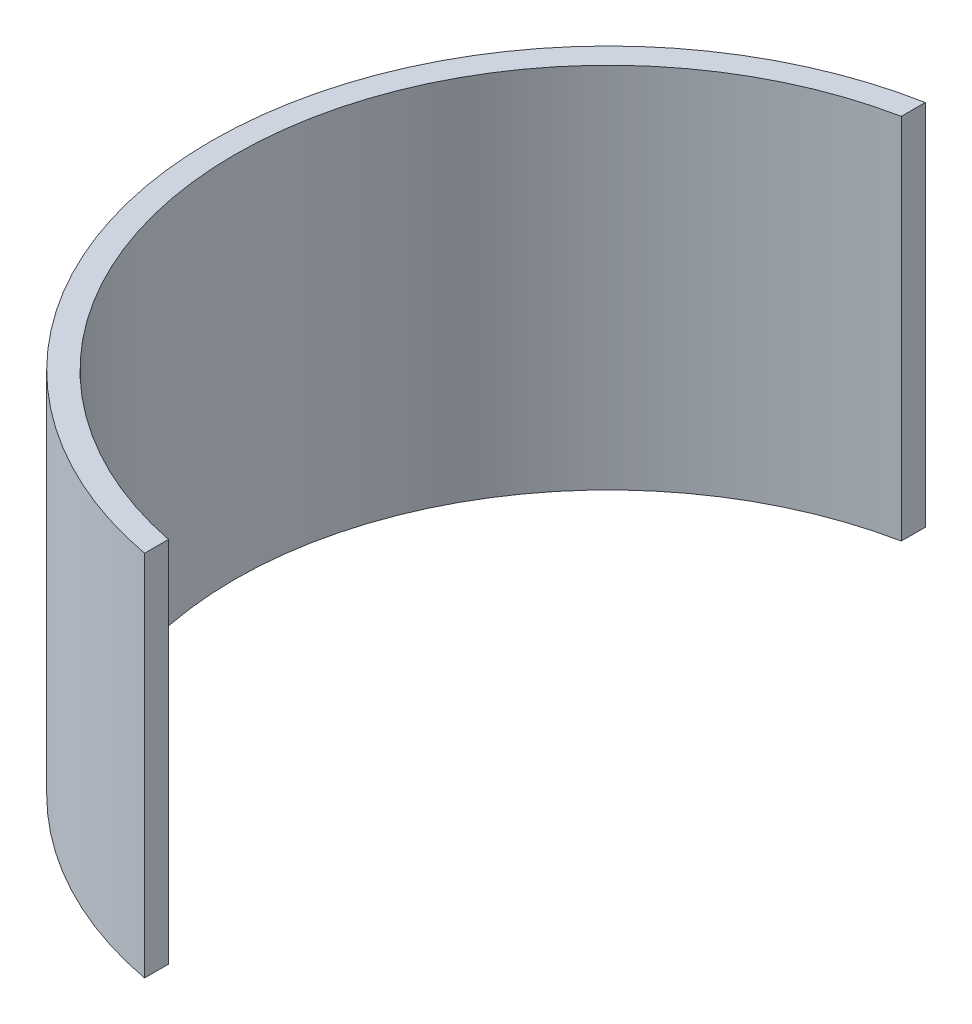
from build123d import *

# Parameters (mm, degrees)
BOSS_EXTRUDE1_DEPTH = 50
SKETCH2_W           = 10
SKETCH2_H           = 108
CUT_EXTRUDE1_DEPTH  = 92.279789658


with BuildPart() as part:
    # Sketch1 → Boss-Extrude1 (new body)
    with BuildSketch(Plane(origin=(0, 0, 0), x_dir=(1, 0, 0), z_dir=(0, 1, 0))):
        with BuildLine():
            Line((0, 54), (0, 50.8))
            ThreePointArc((0, 50.8), (-50.8, 0), (0, -50.8))
            Line((0, -50.8), (0, -54))
            ThreePointArc((0, -54), (-54, 0), (0, 54))
        make_face()
    extrude(amount=BOSS_EXTRUDE1_DEPTH)

    # Sketch2 → Cut-Extrude1 (cut, through all)
    with BuildSketch(Plane(origin=(0, 50, 0), x_dir=(1, 0, 0), z_dir=(0, 1, 0))):
        with Locations((-5, 0)):
            Rectangle(SKETCH2_W, SKETCH2_H)
    extrude(amount=-CUT_EXTRUDE1_DEPTH, mode=Mode.SUBTRACT)


solid = part.part
